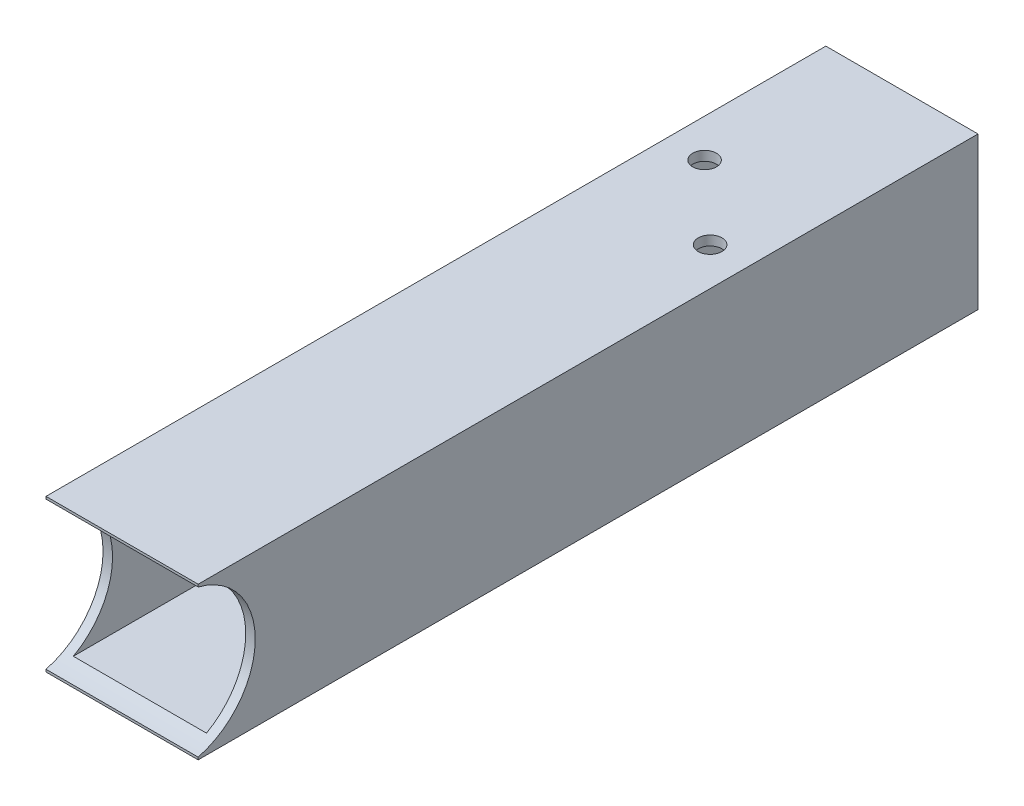
from build123d import *

# Parameters (mm, degrees)
SKETCH1_W           = 50.8
SKETCH1_H           = 50.8
SKETCH1_W_2         = 44.45
SKETCH1_H_2         = 44.45
BOSS_EXTRUDE1_DEPTH = 260.35
SKETCH2_R           = 25.4
CUT_EXTRUDE1_DEPTH  = 271.08036304
SKETCH3_R           = 3.96875
CUT_EXTRUDE2_DEPTH  = 271.08036304


with BuildPart() as part:
    # Sketch1 → Boss-Extrude1 (new body)
    with BuildSketch(Plane.XY):
        with Locations((25.4, 25.4)):
            Rectangle(SKETCH1_W, SKETCH1_H)
        with Locations((25.4, 25.4)):
            Rectangle(SKETCH1_W_2, SKETCH1_H_2, mode=Mode.SUBTRACT)
    extrude(amount=BOSS_EXTRUDE1_DEPTH)

    # Sketch2 → Cut-Extrude1 (cut, through all)
    with BuildSketch(Plane(origin=(50.8, 0, 0), x_dir=(0, 0, -1), z_dir=(1, 0, 0))):
        with Locations((-266.7, 25.4)):
            Circle(SKETCH2_R)
    extrude(amount=-CUT_EXTRUDE1_DEPTH, mode=Mode.SUBTRACT)

    # Sketch3 → Cut-Extrude2 (cut, through all)
    with BuildSketch(Plane.XZ):
        with Locations(Location((38.1, 76.735833685, 0), (0, 0, 270))):
            Circle(SKETCH3_R)
        with Locations(Location((12.7, 53.175, 0), (0, 0, 270))):
            Circle(SKETCH3_R)
    extrude(amount=-CUT_EXTRUDE2_DEPTH, mode=Mode.SUBTRACT)


solid = part.part
